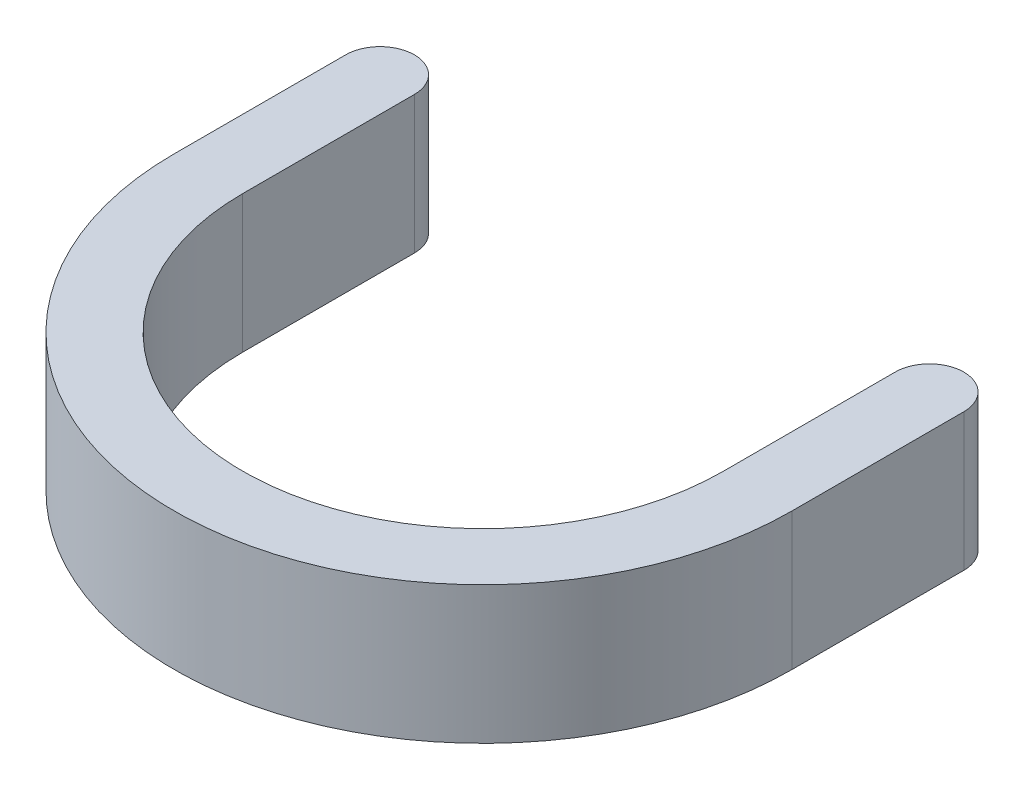
from build123d import *

# Parameters (mm, degrees)
BOSS_EXTRUDE1_DEPTH = 4


with BuildPart() as part:
    # Sketch1 → Boss-Extrude1 (new body)
    with BuildSketch(Plane(origin=(0, 0, 0), x_dir=(1, 0, 0), z_dir=(0, 1, 0))):
        with BuildLine():
            Line((-9, 5), (-9, 0))
            ThreePointArc((-9, 0), (0, -9), (9, 0))
            Line((9, 0), (9, 5))
            ThreePointArc((9, 5), (8, 6), (7, 5))
            Line((7, 5), (7, 0))
            ThreePointArc((7, 0), (0, -7), (-7, 0))
            Line((-7, 0), (-7, 5))
            ThreePointArc((-7, 5), (-8, 6), (-9, 5))
        make_face()
    extrude(amount=BOSS_EXTRUDE1_DEPTH)


solid = part.part
